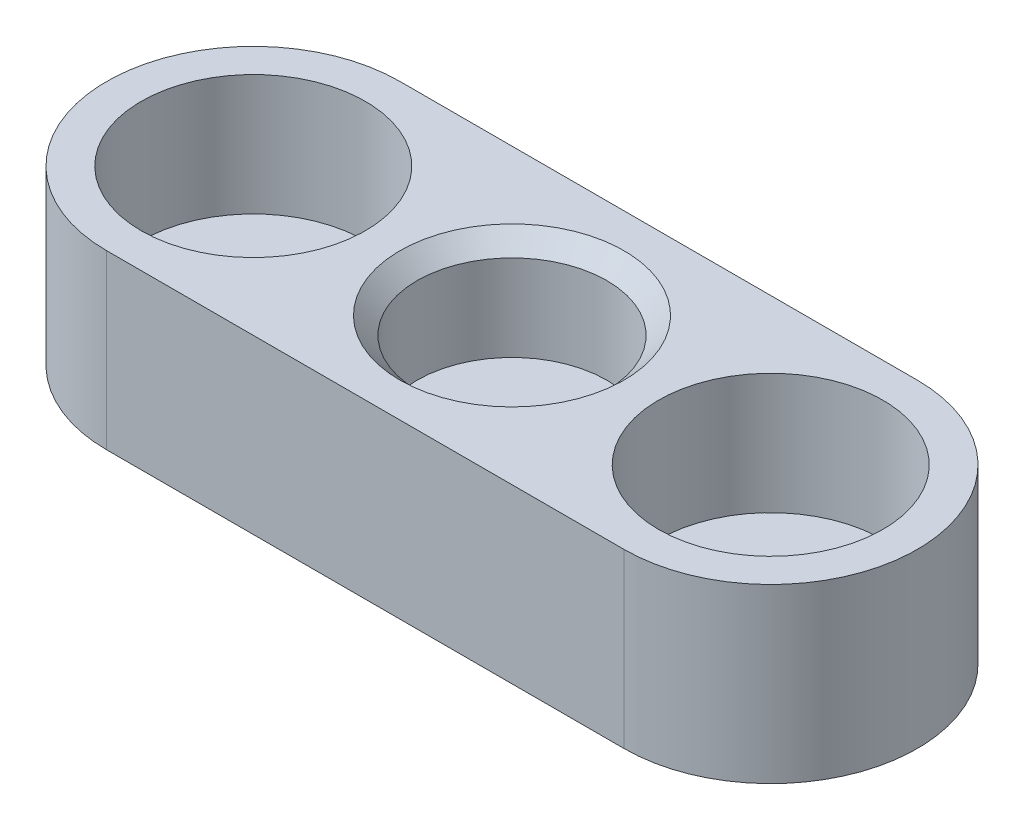
from build123d import *

# Parameters (mm, degrees)
BOSS_EXTRUDE1_DEPTH                                 = 5
SKETCH2_R                                           = 2.75
CUT_EXTRUDE1_DEPTH                                  = 3
CBORE_FOR_M3_HEX_SOCKET_HEAD_CAP_SCREW1_D           = 3.4
CBORE_FOR_M3_HEX_SOCKET_HEAD_CAP_SCREW1_CBORE_D     = 6.5
CBORE_FOR_M3_HEX_SOCKET_HEAD_CAP_SCREW1_CBORE_DEPTH = 3.5
CHAMFER1_SIZE                                       = 0.5


with BuildPart() as part:
    # Sketch1 → Boss-Extrude1 (new body)
    with BuildSketch(Plane(origin=(0, 0, 0), x_dir=(1, 0, 0), z_dir=(0, 1, 0))):
        with BuildLine():
            Line((-7.5, 4.25), (7.5, 4.25))
            ThreePointArc((7.5, 4.25), (11.75, 0), (7.5, -4.25))
            Line((7.5, -4.25), (-7.5, -4.25))
            ThreePointArc((-7.5, -4.25), (-11.75, 0), (-7.5, 4.25))
        make_face()
    extrude(amount=BOSS_EXTRUDE1_DEPTH)

    # Sketch2 → Cut-Extrude1 (cut)
    with BuildSketch(Plane(origin=(0, 5, 0), x_dir=(1, 0, 0), z_dir=(0, 1, 0))):
        with Locations(Location((0, 0, 0), (0, 0, 270))):
            Circle(SKETCH2_R)
    extrude(amount=-CUT_EXTRUDE1_DEPTH, mode=Mode.SUBTRACT)

    # CBORE for M3 Hex Socket Head Cap Screw1 (through all)
    with Locations(Plane(origin=(0, 5, 0), x_dir=(1, 0, 0), z_dir=(0, 1, 0))):
        with Locations((-7.5, 0), (7.5, 0)):
            CounterBoreHole(CBORE_FOR_M3_HEX_SOCKET_HEAD_CAP_SCREW1_D / 2, CBORE_FOR_M3_HEX_SOCKET_HEAD_CAP_SCREW1_CBORE_D / 2, CBORE_FOR_M3_HEX_SOCKET_HEAD_CAP_SCREW1_CBORE_DEPTH)

    # Chamfer1
    chamfer1_edges = [part.edges().sort_by_distance(p)[0] for p in [
        (0, 5, -2.75),
    ]]
    chamfer(chamfer1_edges, length=CHAMFER1_SIZE)


solid = part.part
